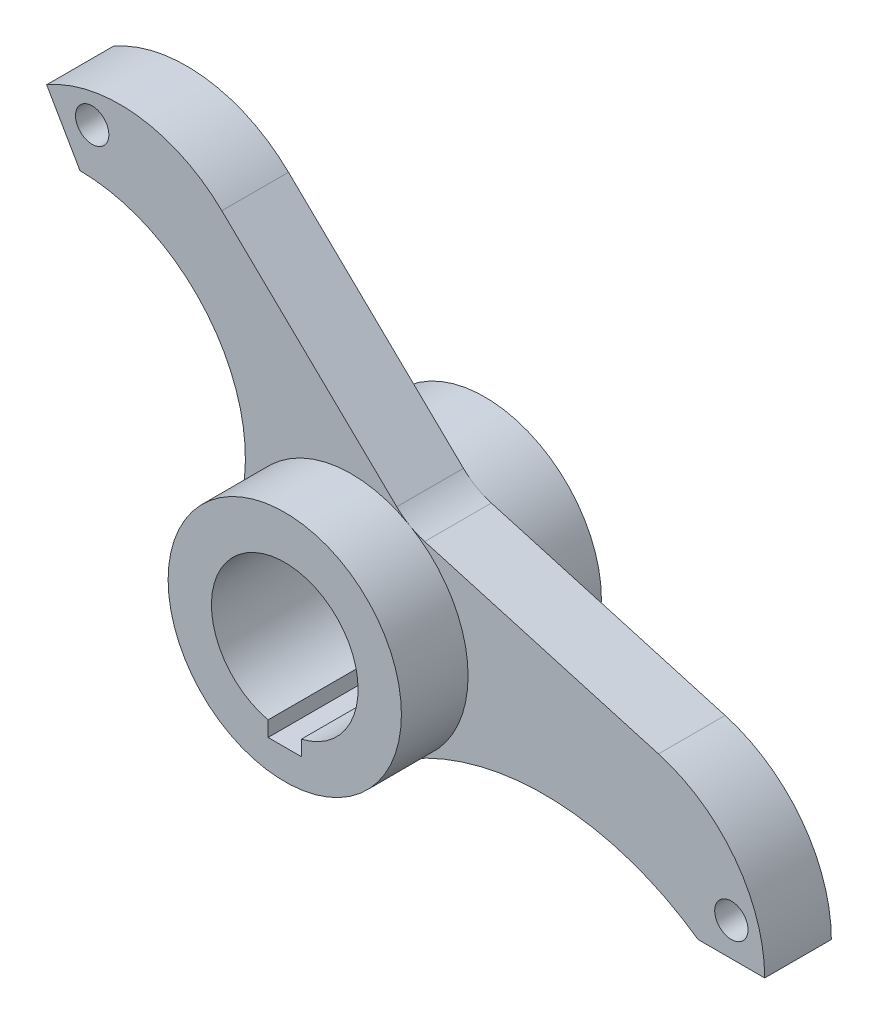
from build123d import *

# Parameters (mm, degrees)
ESTRUSIONE_ESTRUSIONE1_DEPTH   = 5
ESTRUSIONE_ESTRUSIONE1_2_DEPTH = 5
SCHIZZO1_3_R                   = 17.5
ESTRUSIONE_ESTRUSIONE2_DEPTH   = 15
FORO_5_0_5_1_D                 = 5


with BuildPart() as part:
    # Schizzo1 → Estrusione-Estrusione1 (new, symmetric)
    with BuildSketch(Plane.XY):
        with BuildLine():
            ThreePointArc((-19.439551712, 41.966109335), (-32.041033104, 47.97699794), (-45.722431864, 45.193575035))
            Line((-45.722431864, 45.193575035), (-40.722431864, 36.533320997))
            ThreePointArc((-40.722431864, 36.533320997), (-20.917414575, 26.550556749), (-16.843225773, 4.749288954))
            ThreePointArc((-16.843225773, 4.749288954), (-6.591441138, 16.211196863), (8.74999975, 15.155444711))
            ThreePointArc((8.74999975, 15.155444711), (7.731749731, 15.829418888), (6.803236294, 16.62247443))
            Line((6.803236294, 16.62247443), (-19.439551712, 41.966109335))
        make_face()
    extrude(amount=ESTRUSIONE_ESTRUSIONE1_DEPTH, both=True)



with BuildPart() as body_2:
    # Schizzo1 → Estrusione-Estrusione1 2 (new, symmetric)
    with BuildSketch(Plane.XY):
        with BuildLine():
            ThreePointArc((17.5, 0), (15.172291449, -8.720755253), (8.808391751, -15.121581755))
            ThreePointArc((8.808391751, -15.121581755), (30.679829856, -9.722971831), (52, -17))
            Line((52, -17), (62, -17))
            ThreePointArc((62, -17), (57.569815566, -3.759849662), (46.063492638, 4.147909046))
            Line((46.063492638, 4.147909046), (10.993866983, 14.203012674))
            ThreePointArc((10.993866983, 14.203012674), (9.842803753, 14.61060124), (8.74999975, 15.155444711))
            ThreePointArc((8.74999975, 15.155444711), (15.155444494, 8.750000125), (17.5, 0))
        make_face()
    extrude(amount=ESTRUSIONE_ESTRUSIONE1_2_DEPTH, both=True)


with BuildPart() as part_1:
    add(part.part)

    add(body_2.part)  # Estrusione-Estrusione2 merges body 2
    # Schizzo1<3> → Estrusione-Estrusione2 (add, symmetric)
    with BuildSketch(Plane.XY):
        Circle(SCHIZZO1_3_R)
        with BuildLine():
            ThreePointArc((2.5, -10.712142643), (0, 11), (-2.5, -10.712142643))
            Line((-2.5, -10.712142643), (-2.5, -13))
            Line((-2.5, -13), (2.5, -13))
            Line((2.5, -13), (2.5, -10.712142643))
        make_face(mode=Mode.SUBTRACT)
    extrude(amount=ESTRUSIONE_ESTRUSIONE2_DEPTH, both=True)

    # Foro Ø5.0 (5)-1 (through all)
    with Locations(Plane.XY.offset(5)):
        with Locations((-38.892304845, 43.363448016), (57, -12)):
            Hole(FORO_5_0_5_1_D / 2)


solid = part_1.part
